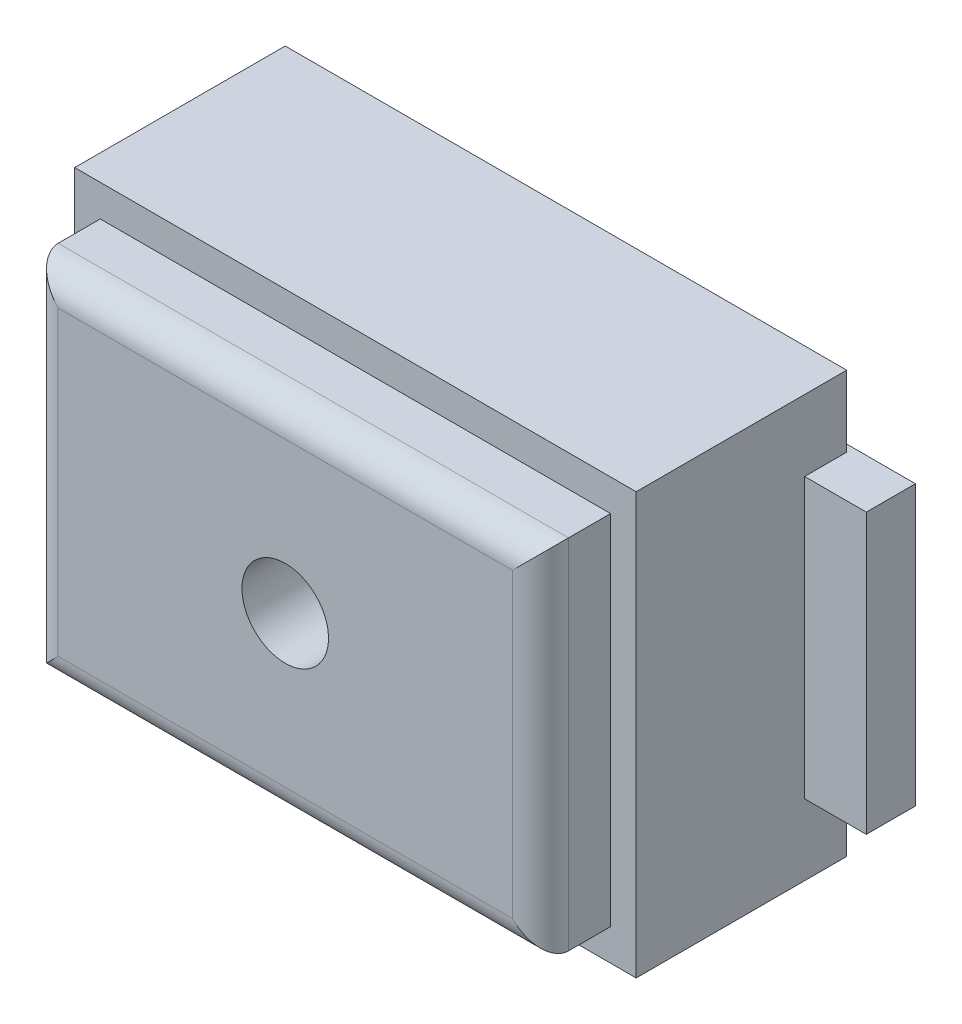
from build123d import *

# Parameters (mm, degrees)
SKETCH_1_W           = 4
SKETCH_1_H           = 3
EXTRUDE_1_DEPTH      = 1.5
EXTRUDE_START        = 1.5
SKETCH_2_W           = 3.635301034
SKETCH_2_H           = 2.54839515
EXTRUDE_2_DEPTH      = 0.5
FILLET_1_R           = 0.2
CUT_EXTRUDE_START    = 2
SKETCH_3_R           = 0.308254008
CUT_EXTRUDE_1_DEPTH  = 0.5
EXTRUDE_3_DEPTH      = 0.3
EXTRUDE_3_DEPTH_BACK = 0.05
SKETCH_4_W           = 0.867892154
SKETCH_4_H           = 1.98843372
SKETCH_4_W_2         = 0.87914193


with BuildPart() as part:
    # 草图1 → 凸台-拉伸1 (new body)
    with BuildSketch(Plane.XY):
        Rectangle(SKETCH_1_W, SKETCH_1_H)
    extrude(amount=EXTRUDE_1_DEPTH)

    # 草图2 → 凸台-拉伸2 (add)
    with BuildSketch(Plane.XY.offset(EXTRUDE_START)):
        Rectangle(SKETCH_2_W, SKETCH_2_H)
    extrude(amount=EXTRUDE_2_DEPTH)

    # 圆角1
    fillet_1_edges = [part.edges().sort_by_distance(p)[0] for p in [
        (0, -1.274197575, 2),
        (1.817650517, 0, 2),
        (0, 1.274197575, 2),
        (-1.817650517, 0, 2),
    ]]
    fillet(fillet_1_edges, radius=FILLET_1_R)

    # 草图3 → 切除-拉伸1 (cut)
    with BuildSketch(Plane.XY.offset(CUT_EXTRUDE_START)):
        with Locations(Location((0, 0, 0), (0, 0, 180))):
            Circle(SKETCH_3_R)
    extrude(amount=-CUT_EXTRUDE_1_DEPTH, mode=Mode.SUBTRACT)

    # 草图4 → 凸台-拉伸3 (add, two sides: drawn at the far end of the back side and taken through both)
    with BuildSketch(Plane.XY.offset(-EXTRUDE_3_DEPTH_BACK)):
        with Locations((-2.016645535, 0)):
            Rectangle(SKETCH_4_W, SKETCH_4_H)
        with Locations((2, 0)):
            Rectangle(SKETCH_4_W_2, SKETCH_4_H)
    extrude(amount=EXTRUDE_3_DEPTH + EXTRUDE_3_DEPTH_BACK)


solid = part.part
